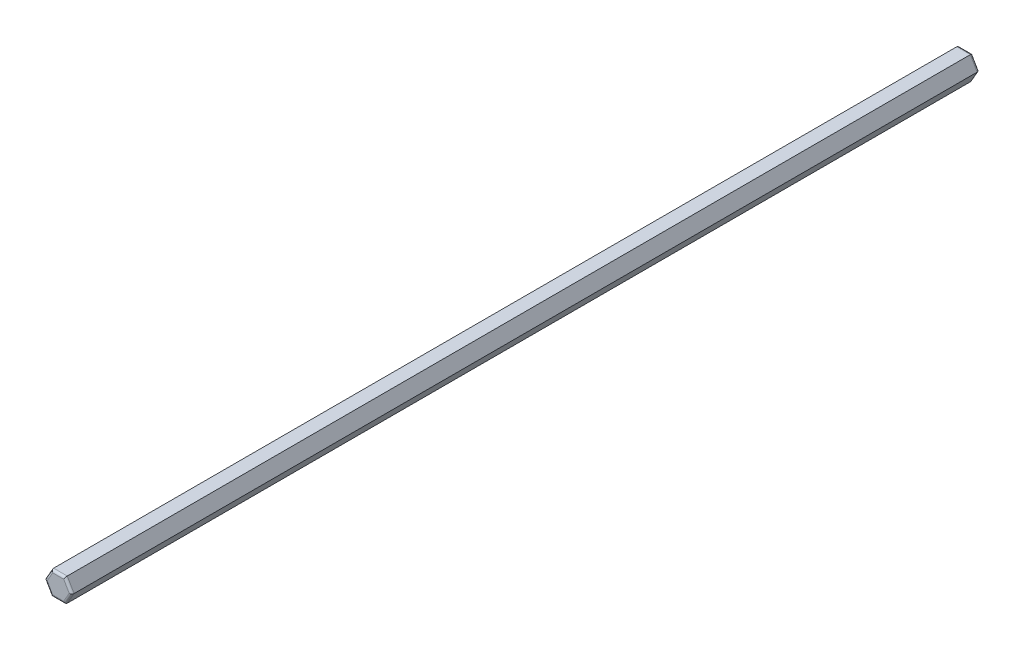
from build123d import *

# Parameters (mm, degrees)
BOSS_EXTRUDE1_DEPTH      = 50
BOSS_EXTRUDE1_DEPTH_BACK = 50
FILLET1_R                = 0.25


with BuildPart() as part:
    # Sketch2 → Boss-Extrude1 (new, two sides: drawn at the far end of the back side and taken through both)
    with BuildSketch(Plane.XY.offset(-BOSS_EXTRUDE1_DEPTH_BACK)):
        Polygon((-0.75, 1.299038106), (-1.5, 0), (-0.75, -1.299038106), (0.75, -1.299038106), (1.5, 0), (0.75, 1.299038106), align=None)
    extrude(amount=BOSS_EXTRUDE1_DEPTH + BOSS_EXTRUDE1_DEPTH_BACK)

    # Fillet1
    fillet1_edges = [part.edges().sort_by_distance(p)[0] for p in [
        (1.125, -0.649519053, -50),
        (0, -1.299038106, -50),
        (-1.125, -0.649519053, -50),
        (-1.125, 0.649519053, -50),
        (0, 1.299038106, -50),
        (1.125, 0.649519053, -50),
        (-1.125, 0.649519053, 50),
        (-1.125, -0.649519053, 50),
        (0, -1.299038106, 50),
        (1.125, -0.649519053, 50),
        (1.125, 0.649519053, 50),
        (0, 1.299038106, 50),
    ]]
    fillet(fillet1_edges, radius=FILLET1_R)


solid = part.part
